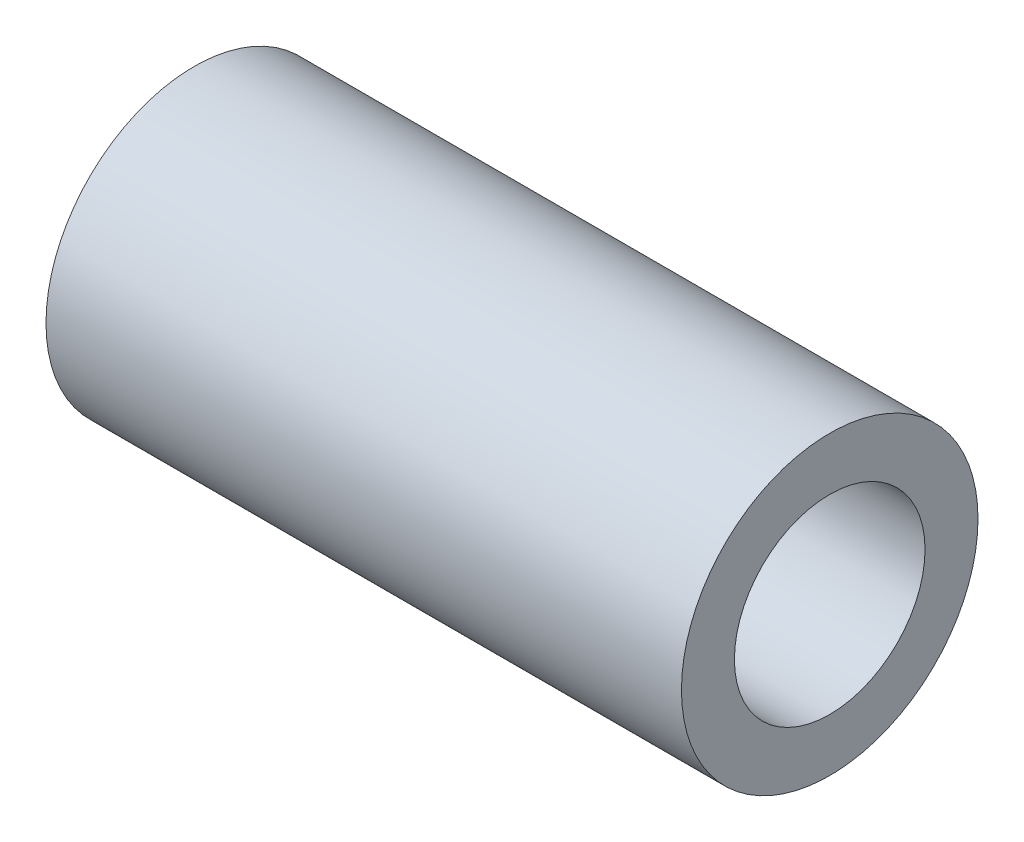
from build123d import *

# Parameters (mm, degrees)
SKETCH1_W = 1.524
SKETCH1_H = 0.127


with BuildPart() as part:
    # Sketch1 → Revolve1 (revolve)
    with BuildSketch(Plane.XY, mode=Mode.PRIVATE) as revolve1_sk:
        with Locations((-0.762, 0.2921)):
            Rectangle(SKETCH1_W, SKETCH1_H)
    revolve(revolve1_sk.sketch.rotate(Axis((-1.524, 0, 0), (1, 0, 0)), 270), axis=Axis((-1.524, 0, 0), (1, 0, 0)))


solid = part.part
